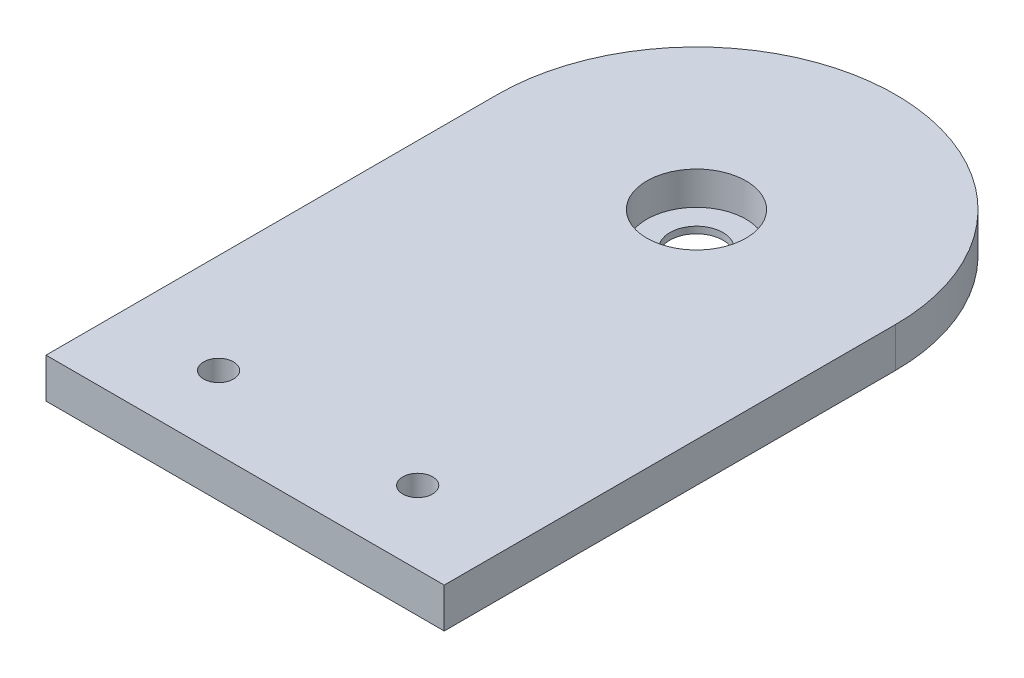
from build123d import *

# Parameters (mm, degrees)
PLACA_START              = -65.75
SK_PLACA_W               = 60
SK_PLACA_H               = 49
PLACA_DEPTH              = 6
EXTREMO_START            = -65.75
SK_EXTREMO_R             = 30
EXTREMO_DEPTH            = 6
ALOJAMIENTO_696ZZ_START  = -64.75
SK_ALOJAMIENTO_696ZZ_R   = 7.475
ALOJAMIENTO_696ZZ_DEPTH  = 5
PASO_EXTRACTOR_START     = -65.75
SK_PASO_EXTRACTOR_R      = 4
PASO_EXTRACTOR_DEPTH     = 1
EXTENSION_PESTANAS_START = -65.75
SK_EXTENSION_PESTANAS_W  = 60
SK_EXTENSION_PESTANAS_H  = 19
EXTENSION_PESTANAS_DEPTH = 6
PASANTES_M4_REPISA_START = -65.75
SK_PASANTES_M4_REPISA_R  = 2.25
PASANTES_M4_REPISA_DEPTH = 6


with BuildPart() as part:
    # Sk_Placa → Placa (new body)
    with BuildSketch(Plane(origin=(0, 0, 0), x_dir=(1, 0, 0), z_dir=(0, 1, 0)).offset(PLACA_START)):
        with Locations((0, -354.5)):
            Rectangle(SK_PLACA_W, SK_PLACA_H)
    extrude(amount=PLACA_DEPTH)

    # Sk_Extremo → Extremo (add)
    with BuildSketch(Plane(origin=(0, 0, 0), x_dir=(1, 0, 0), z_dir=(0, 1, 0)).offset(EXTREMO_START)):
        with Locations((0, -330)):
            Circle(SK_EXTREMO_R)
    extrude(amount=EXTREMO_DEPTH)

    # Sk_Alojamiento_696ZZ → Alojamiento_696ZZ (cut)
    with BuildSketch(Plane(origin=(0, 0, 0), x_dir=(1, 0, 0), z_dir=(0, 1, 0)).offset(ALOJAMIENTO_696ZZ_START)):
        with Locations(Location((0, -330, 0), (0, 0, 270))):
            Circle(SK_ALOJAMIENTO_696ZZ_R)
    extrude(amount=ALOJAMIENTO_696ZZ_DEPTH, mode=Mode.SUBTRACT)

    # Sk_Paso_extractor → Paso_extractor (cut)
    with BuildSketch(Plane(origin=(0, 0, 0), x_dir=(1, 0, 0), z_dir=(0, 1, 0)).offset(PASO_EXTRACTOR_START)):
        with Locations(Location((0, -330, 0), (0, 0, 270))):
            Circle(SK_PASO_EXTRACTOR_R)
    extrude(amount=PASO_EXTRACTOR_DEPTH, mode=Mode.SUBTRACT)

    # Sk_Extension_pestanas → Extension_pestanas (add)
    with BuildSketch(Plane(origin=(0, 0, 0), x_dir=(1, 0, 0), z_dir=(0, 1, 0)).offset(EXTENSION_PESTANAS_START)):
        with Locations((0, -388.5)):
            Rectangle(SK_EXTENSION_PESTANAS_W, SK_EXTENSION_PESTANAS_H)
    extrude(amount=EXTENSION_PESTANAS_DEPTH)

    # Sk_Pasantes_M4_repisa → Pasantes_M4_repisa (cut)
    with BuildSketch(Plane(origin=(0, 0, 0), x_dir=(1, 0, 0), z_dir=(0, 1, 0)).offset(PASANTES_M4_REPISA_START)):
        with Locations(Location((-15, -387, 0), (0, 0, 270))):
            Circle(SK_PASANTES_M4_REPISA_R)
        with Locations(Location((15, -387, 0), (0, 0, 270))):
            Circle(SK_PASANTES_M4_REPISA_R)
    extrude(amount=PASANTES_M4_REPISA_DEPTH, mode=Mode.SUBTRACT)


solid = part.part
